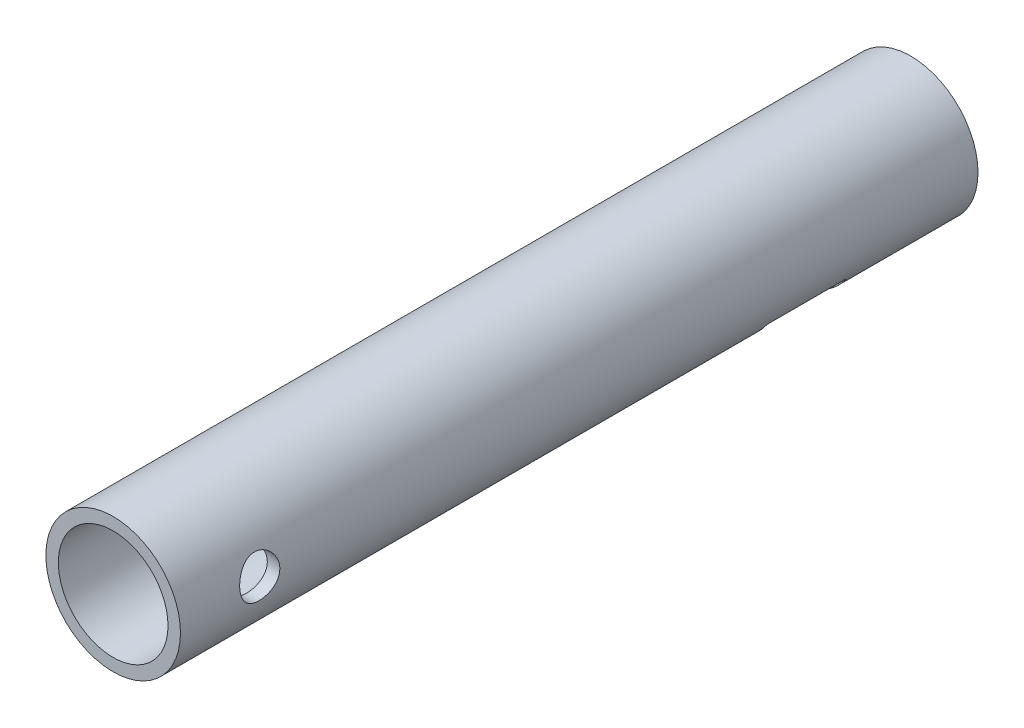
from build123d import *

# Parameters (mm, degrees)
SKETCH1_R               = 10.715625
SKETCH1_R_2             = 8.73125
BOSS_EXTRUDE1_DEPTH     = 127
SKETCH2_W               = 17.78
SKETCH2_H               = 12.7
CUT_EXTRUDE1_DEPTH      = 128.900935252
CUT_EXTRUDE2_DEPTH      = 128.900935252
CUT_EXTRUDE2_DEPTH_BACK = 128.900935252
SKETCH5_R               = 3.175


with BuildPart() as part:
    # Sketch1 → Boss-Extrude1 (new body)
    with BuildSketch(Plane.XY):
        Circle(SKETCH1_R)
        Circle(SKETCH1_R_2, mode=Mode.SUBTRACT)
    extrude(amount=BOSS_EXTRUDE1_DEPTH)

    # Sketch2 → Cut-Extrude1 (cut, through all)
    with BuildSketch(Plane(origin=(0, 0, 0), x_dir=(1, 0, 0), z_dir=(0, 1, 0))):
        with Locations((0, -25.4)):
            Rectangle(SKETCH2_W, SKETCH2_H)
    extrude(amount=-CUT_EXTRUDE1_DEPTH, mode=Mode.SUBTRACT)

    # Sketch5 → Cut-Extrude2 (cut, two sides: drawn at the far end of the back side and taken through both)
    with BuildSketch(Plane(origin=(0, 0, 0), x_dir=(0, 0, -1), z_dir=(1, 0, 0)).offset(-CUT_EXTRUDE2_DEPTH_BACK)):
        with Locations((-114.3, 1.190625)):
            Circle(SKETCH5_R)
    extrude(amount=CUT_EXTRUDE2_DEPTH + CUT_EXTRUDE2_DEPTH_BACK, mode=Mode.SUBTRACT)


solid = part.part
